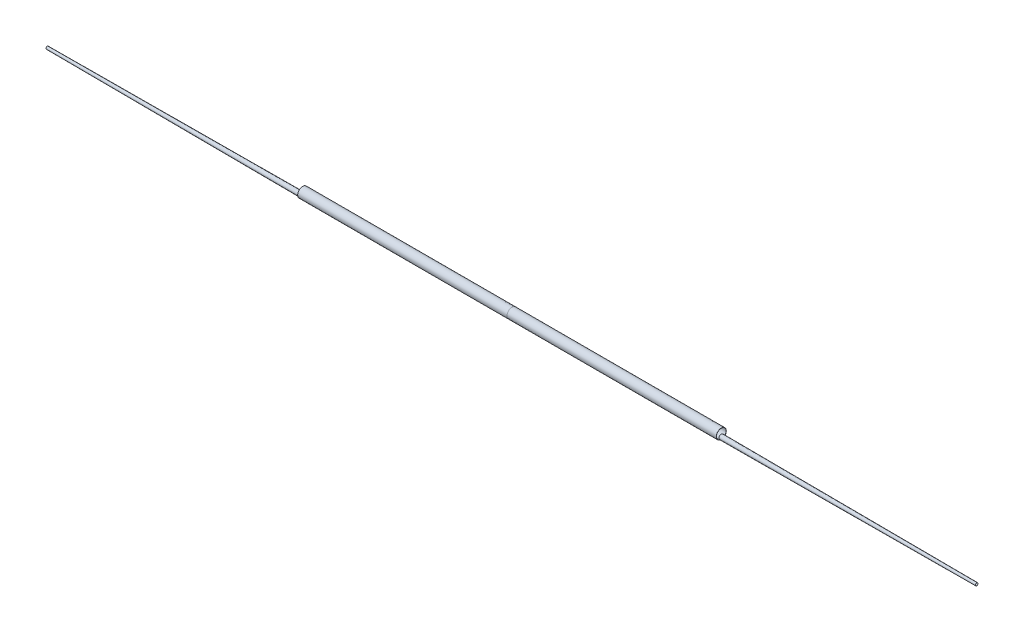
from build123d import *

# Parameters (mm, degrees)
SKETCH1_R            = 17.907
UNIFORM_TUBE_DEPTH   = 749.3
UNIFORM_TUBE_SHELL_T = -0.762
SKETCH3_R            = 4.6609
SKETCH2_R            = 8.4455
TAPERED_TUBE_SHELL_T = -0.254


with BuildPart() as part:
    # Sketch1 → Uniform Tube (new body)
    with BuildSketch(Plane(origin=(0, 0, 0), x_dir=(0, 0, -1), z_dir=(1, 0, 0))):
        with Locations(Location((363.728, 24.54402, 0), (0, 0, 180))):
            Circle(SKETCH1_R)
    extrude(amount=UNIFORM_TUBE_DEPTH)

    # Uniform Tube Shell
    uniform_tube_shell_openings = [part.faces().sort_by_distance(p)[0] for p in [
        (749.3, 24.54402, -363.728),
        (0, 24.54402, -363.728),
    ]]
    offset(amount=UNIFORM_TUBE_SHELL_T, openings=uniform_tube_shell_openings, kind=Kind.INTERSECTION)


with BuildPart() as body_2:
    # Sketch3 → Tapered Tube section 0
    with BuildSketch(Plane(origin=(1663.7, 0, 0), x_dir=(0, 0, -1), z_dir=(1, 0, 0))):
        with Locations((363.728, 15.08252)):
            Circle(SKETCH3_R)
    # Sketch2 → Tapered Tube section 1
    with BuildSketch(Plane(origin=(749.3, 0, 0), x_dir=(0, 0, -1), z_dir=(1, 0, 0))):
        with Locations((363.728, 15.08252)):
            Circle(SKETCH2_R)
    loft()

    # Tapered Tube Shell
    tapered_tube_shell_openings = [body_2.faces().sort_by_distance(p)[0] for p in [
        (749.3, 15.08252, -363.728),
        (1663.7, 15.08252, -363.728),
    ]]
    offset(amount=TAPERED_TUBE_SHELL_T, openings=tapered_tube_shell_openings, kind=Kind.INTERSECTION)


with BuildPart() as body_3:
    # Mirror2: mirrored copy
    add(body_2.part.mirror(Plane(origin=(0, 0, 0), x_dir=(0, 0, 1), z_dir=(1, 0, 0))))


with BuildPart() as body_4:
    # Mirror2 2: mirrored copy
    add(part.part.mirror(Plane(origin=(0, 0, 0), x_dir=(0, 0, 1), z_dir=(1, 0, 0))))


solid = Compound([part.part, body_2.part, body_3.part, body_4.part])
